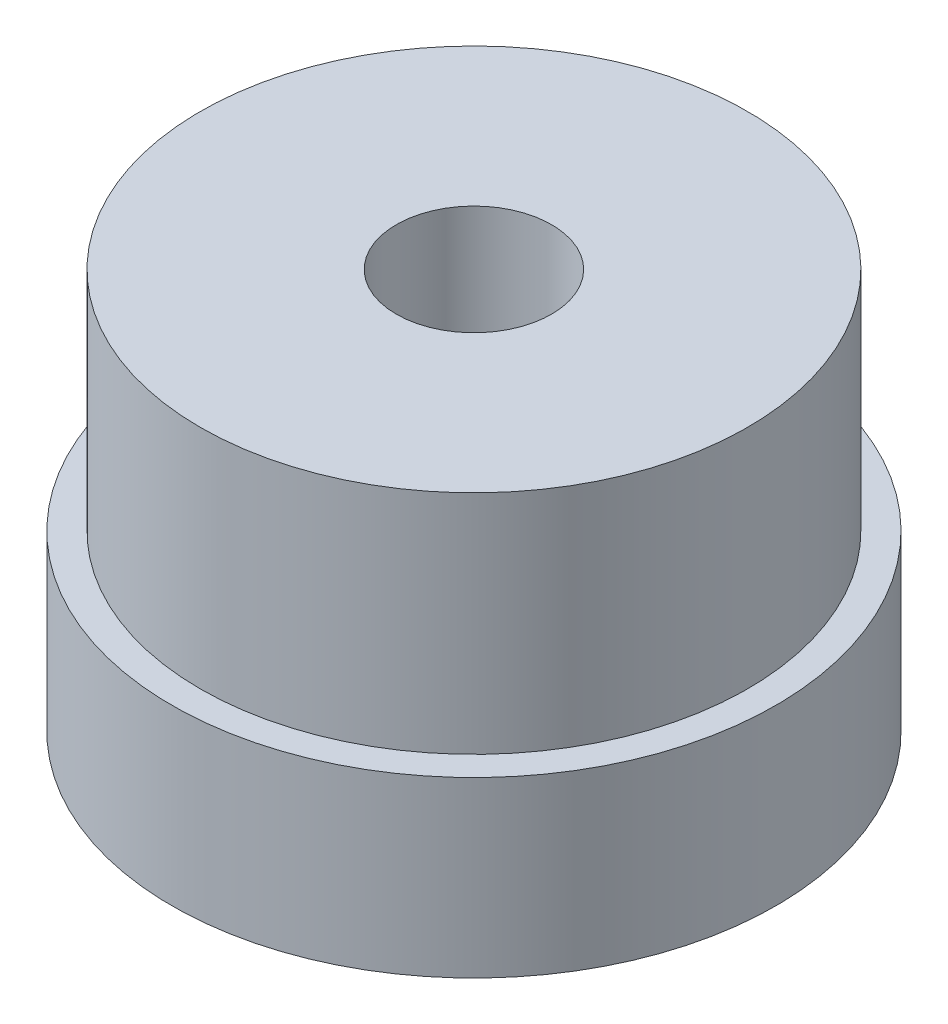
from build123d import *

# Parameters (mm, degrees)
SKETCH1_R           = 11.5062
SKETCH1_R_2         = 3.2639
BOSS_EXTRUDE1_DEPTH = 16.8275
SKETCH1_3_R         = 12.7
SKETCH1_3_R_2       = 11.5062
BOSS_EXTRUDE2_DEPTH = 7.3025


with BuildPart() as part:
    # Sketch1 → Boss-Extrude1 (new body)
    with BuildSketch(Plane(origin=(0, 0, 0), x_dir=(1, 0, 0), z_dir=(0, 1, 0))):
        Circle(SKETCH1_R)
        Circle(SKETCH1_R_2, mode=Mode.SUBTRACT)
    extrude(amount=BOSS_EXTRUDE1_DEPTH)

    # Sketch1<3> → Boss-Extrude2 (add)
    with BuildSketch(Plane(origin=(0, 0, 0), x_dir=(1, 0, 0), z_dir=(0, 1, 0))):
        Circle(SKETCH1_3_R)
        Circle(SKETCH1_3_R_2, mode=Mode.SUBTRACT)
    extrude(amount=BOSS_EXTRUDE2_DEPTH)


solid = part.part
